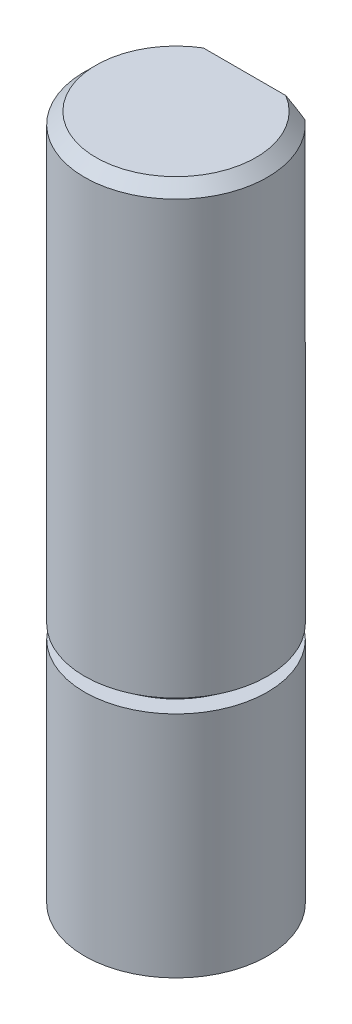
from build123d import *

# Parameters (mm, degrees)
BOSS_EXTRUDE1_DEPTH      = 20
BOSS_EXTRUDE1_DEPTH_BACK = 10
SKETCH1_R                = 4
CHAMFER1_SIZE            = 0.5
CUT_EXTRUDE1_DEPTH       = 12
SKETCH3_W                = 1.701892275
SKETCH3_H                = 0.6


with BuildPart() as part:
    # Sketch1 → Boss-Extrude1 (new, two sides: drawn at the far end of the back side and taken through both)
    with BuildSketch(Plane(origin=(0, 0, 0), x_dir=(1, 0, 0), z_dir=(0, 1, 0)).offset(-BOSS_EXTRUDE1_DEPTH_BACK)):
        with Locations(Location((0, 0, 0), (0, 0, 270))):
            Circle(SKETCH1_R)
    extrude(amount=BOSS_EXTRUDE1_DEPTH + BOSS_EXTRUDE1_DEPTH_BACK)

    # Chamfer1
    chamfer1_edges = [part.edges().sort_by_distance(p)[0] for p in [
        (0, 20, -4),
    ]]
    chamfer(chamfer1_edges, length=CHAMFER1_SIZE)

    # Sketch2 → Cut-Extrude1 (cut)
    with BuildSketch(Plane(origin=(0, 20, 0), x_dir=(1, 0, 0), z_dir=(0, 1, 0))):
        with BuildLine():
            Line((-2.645751311, 3), (2.645751311, 3))
            ThreePointArc((2.645751311, 3), (0, 4), (-2.645751311, 3))
        make_face()
    extrude(amount=-CUT_EXTRUDE1_DEPTH, mode=Mode.SUBTRACT)

    # Sketch3 → Cut-Revolve1 (revolve, cut)
    with BuildSketch(Plane(origin=(0, 0, 0), x_dir=(0, 0, -1), z_dir=(1, 0, 0)), mode=Mode.PRIVATE) as cut_revolve1_sk:
        with Locations((4.050946138, 0.3)):
            Rectangle(SKETCH3_W, SKETCH3_H)
    revolve(cut_revolve1_sk.sketch.rotate(Axis((0, 0, 0), (0, 1, 0)), 180), axis=Axis((0, 0, 0), (0, 1, 0)), mode=Mode.SUBTRACT)


solid = part.part
